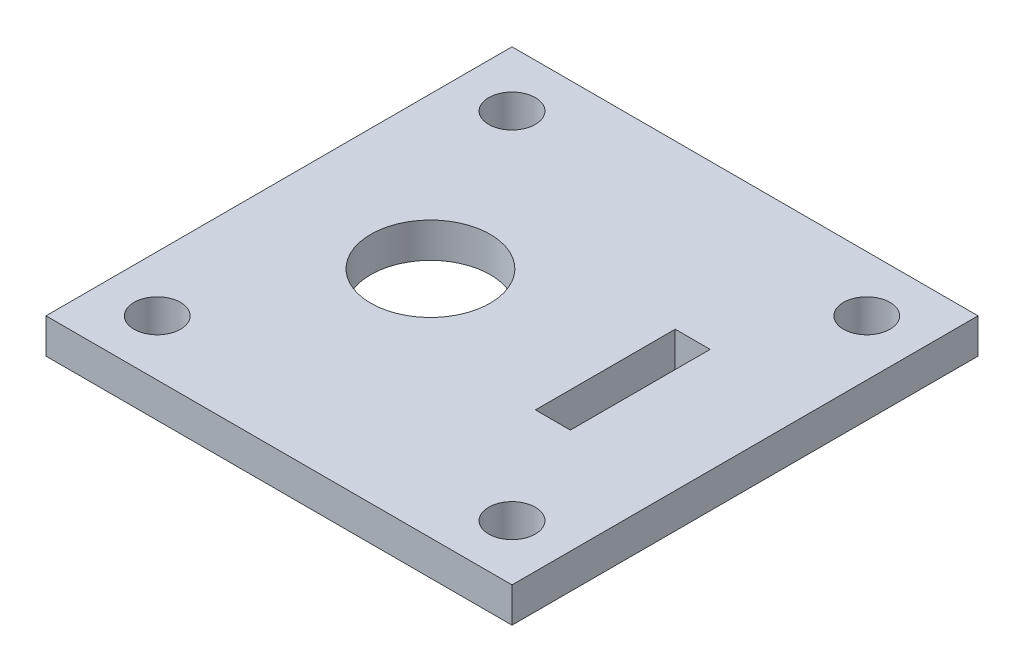
from build123d import *

# Parameters (mm, degrees)
SKETCH_2_W          = 40
SKETCH_2_H          = 40
EXTRUDE_2_DEPTH     = 3
SKETCH_3_R          = 2
SKETCH_3_R_2        = 5.125
SKETCH_3_W          = 3
SKETCH_3_H          = 12
CUT_EXTRUDE_1_DEPTH = 3


with BuildPart() as part:
    # 草图2 → 凸台-拉伸2 (new body)
    with BuildSketch(Plane(origin=(0, 0, 0), x_dir=(1, 0, 0), z_dir=(0, 1, 0))):
        Rectangle(SKETCH_2_W, SKETCH_2_H)
    extrude(amount=EXTRUDE_2_DEPTH)

    # 草图3 → 切除-拉伸1 (cut)
    with BuildSketch(Plane(origin=(0, 0, 0), x_dir=(1, 0, 0), z_dir=(0, 1, 0))):
        with Locations(Location((-15.224798987, -15.224798987, 0), (0, 0, 270))):
            Circle(SKETCH_3_R)
        with Locations(Location((15.224798987, -15.224798987, 0), (0, 0, 270))):
            Circle(SKETCH_3_R)
        with Locations(Location((15.224798987, 15.224798987, 0), (0, 0, 270))):
            Circle(SKETCH_3_R)
        with Locations(Location((-15.224798987, 15.224798987, 0), (0, 0, 270))):
            Circle(SKETCH_3_R)
        with Locations(Location((-7, 0, 0), (0, 0, 270))):
            Circle(SKETCH_3_R_2)
        with Locations((9.5, 0.011605537)):
            Rectangle(SKETCH_3_W, SKETCH_3_H)
    extrude(amount=CUT_EXTRUDE_1_DEPTH, mode=Mode.SUBTRACT)


solid = part.part
